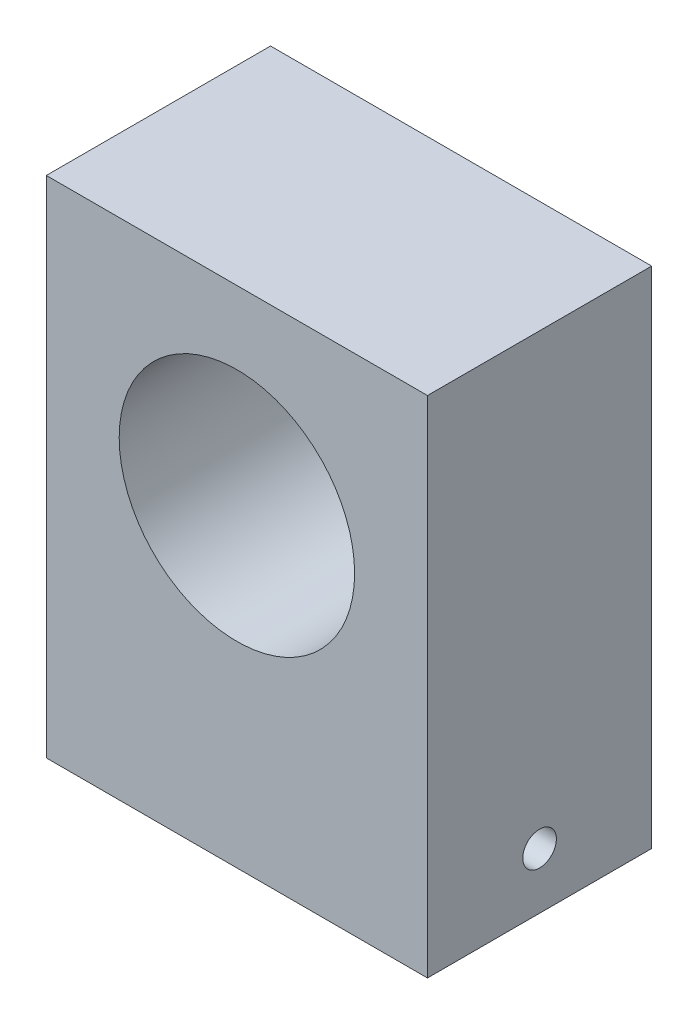
from build123d import *

# Parameters (mm, degrees)
SKETCH_3_W          = 34
SKETCH_3_H          = 45
EXTRUDE_1_DEPTH     = 20
SKETCH_4_R          = 10.5
CUT_EXTRUDE_1_DEPTH = 60.841457202
SKETCH_7_W          = 15.3
SKETCH_7_H          = 12
CUT_EXTRUDE_2_DEPTH = 14
SKETCH_9_R          = 1.5
CUT_EXTRUDE_3_DEPTH = 60.841457202


with BuildPart() as part:
    # 草图3 → 凸台-拉伸1 (new body)
    with BuildSketch(Plane.XY):
        with Locations((17, 22.5)):
            Rectangle(SKETCH_3_W, SKETCH_3_H)
    extrude(amount=-EXTRUDE_1_DEPTH)

    # 草图4 → 切除-拉伸1 (cut, through all)
    with BuildSketch(Plane.XY):
        with Locations((17, 28)):
            Circle(SKETCH_4_R)
    extrude(amount=-CUT_EXTRUDE_1_DEPTH, mode=Mode.SUBTRACT)

    # 草图7 → 切除-拉伸2 (cut)
    with BuildSketch(Plane(origin=(0, 0, -20), x_dir=(-1, 0, 0), z_dir=(0, 0, -1))):
        with Locations((-17, 6)):
            Rectangle(SKETCH_7_W, SKETCH_7_H)
    extrude(amount=-CUT_EXTRUDE_2_DEPTH, mode=Mode.SUBTRACT)

    # 草图9 → 切除-拉伸3 (cut, through all)
    with BuildSketch(Plane(origin=(34, 0, 0), x_dir=(0, 0, -1), z_dir=(1, 0, 0))):
        with Locations(Location((10, 5, 0), (0, 0, 90))):
            Circle(SKETCH_9_R)
    extrude(amount=-CUT_EXTRUDE_3_DEPTH, mode=Mode.SUBTRACT)


solid = part.part
